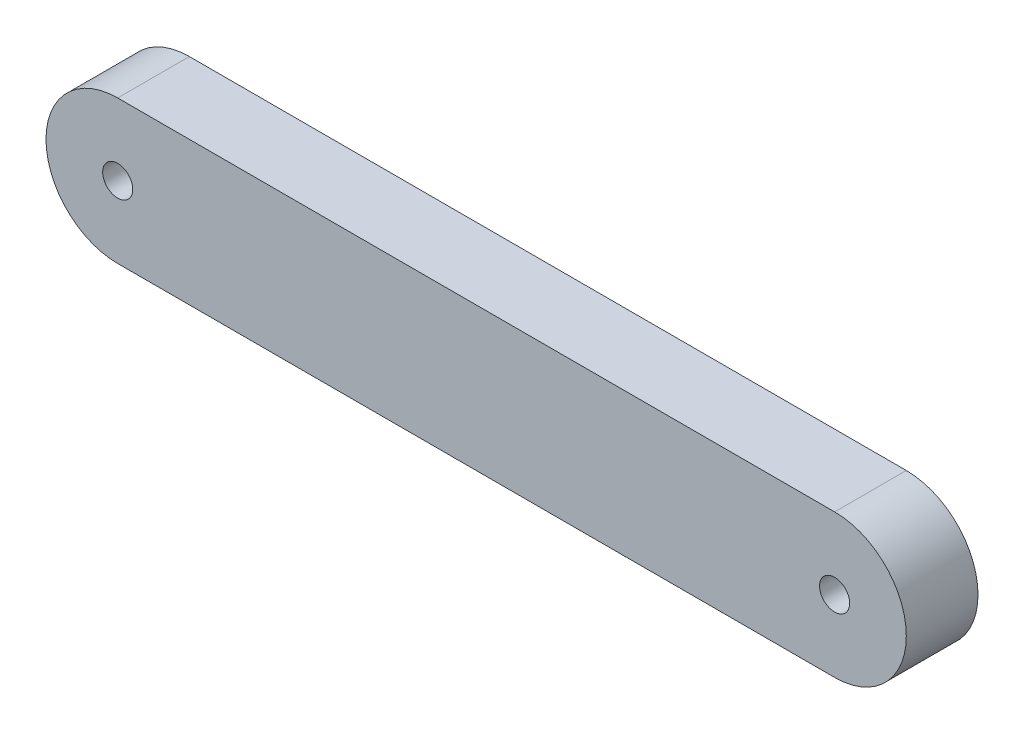
from build123d import *

# Parameters (mm, degrees)
EXTRUDE_1_DEPTH          = 5
CUT_EXTRUDE_3_DEPTH      = 31.822070015
CUT_EXTRUDE_3_DEPTH_BACK = 31.822070015
SKETCH_5_R               = 1.05


with BuildPart() as part:
    # ｽｹｯﾁ1 → ﾎﾞｽ - 押し出し1 (new body)
    with BuildSketch(Plane.XY):
        with BuildLine():
            ThreePointArc((-25, 5), (-30, 0), (-25, -5))
            Line((-25, -5), (-25, 5))
        make_face()
        with BuildLine():
            Line((-25, 5), (-25, -5))
            ThreePointArc((-25, -5), (-21.464466094, -3.535533906), (-20, 0))
            ThreePointArc((-20, 0), (-21.464466094, 3.535533906), (-25, 5))
        make_face()
        with BuildLine():
            ThreePointArc((-20, 0), (-21.464466094, -3.535533906), (-25, -5))
            Line((-25, -5), (25, -5))
            ThreePointArc((25, -5), (20, 0), (25, 5))
            Line((25, 5), (-25, 5))
            ThreePointArc((-25, 5), (-21.464466094, 3.535533906), (-20, 0))
        make_face()
        with BuildLine():
            ThreePointArc((25, 5), (20, 0), (25, -5))
            Line((25, -5), (25, 5))
        make_face()
        with BuildLine():
            Line((25, 5), (25, -5))
            ThreePointArc((25, -5), (28.535533906, -3.535533906), (30, 0))
            ThreePointArc((30, 0), (28.535533906, 3.535533906), (25, 5))
        make_face()
    extrude(amount=EXTRUDE_1_DEPTH)

    # ｽｹｯﾁ5 → ｶｯﾄ - 押し出し3 (cut, two sides: drawn at the far end of the back side and taken through both)
    with BuildSketch(Plane.XY.offset(-CUT_EXTRUDE_3_DEPTH_BACK)):
        with Locations((25, 0)):
            Circle(SKETCH_5_R)
        with Locations((-25, 0)):
            Circle(SKETCH_5_R)
    extrude(amount=CUT_EXTRUDE_3_DEPTH + CUT_EXTRUDE_3_DEPTH_BACK, mode=Mode.SUBTRACT)


solid = part.part
